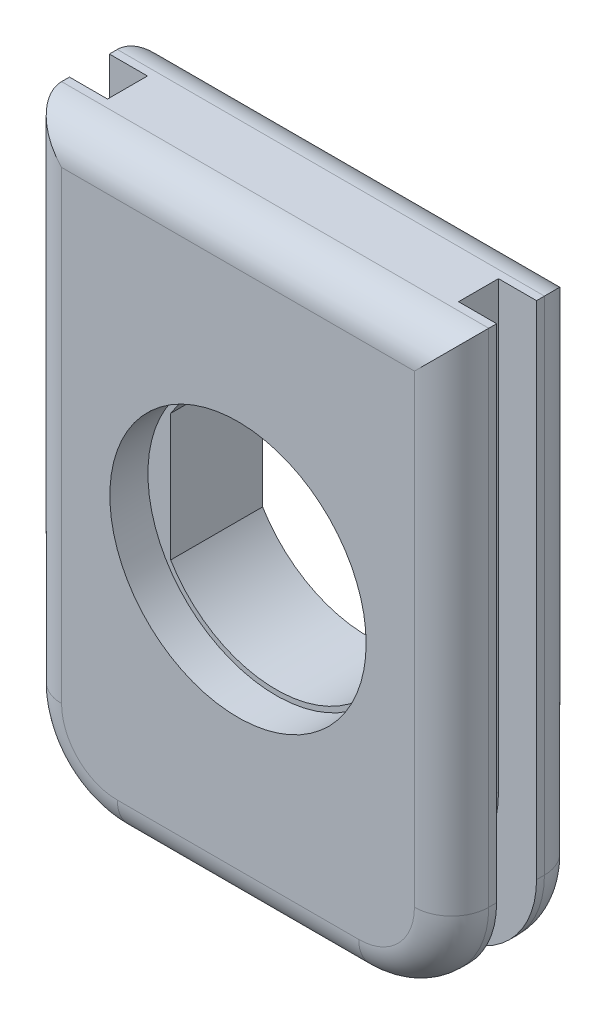
from build123d import *

# Parameters (mm, degrees)
SKETCH1_W           = 23
SKETCH1_H           = 32
BOSS_EXTRUDE1_DEPTH = 3.5
CUT_EXTRUDE1_DEPTH  = 1.075
FILLET1_R           = 6
FILLET2_R           = 5
FILLET3_R           = 2
CUT_EXTRUDE2_DEPTH  = 21.910523666
SKETCH5_R           = 6.9
CUT_EXTRUDE3_DEPTH  = 2.05


with BuildPart() as part:
    # Sketch1 → Boss-Extrude1 (new, symmetric)
    with BuildSketch(Plane.XY):
        Rectangle(SKETCH1_W, SKETCH1_H)
    extrude(amount=BOSS_EXTRUDE1_DEPTH, both=True)

    # Sketch2 → Cut-Extrude1 (cut, symmetric)
    with BuildSketch(Plane.XY):
        Polygon((-9.45, 16), (-11.5, 16), (-11.5, -16), (11.5, -16), (11.5, 16), (9.45, 16), (9.45, -13.95), (-9.45, -13.95), align=None)
    extrude(amount=CUT_EXTRUDE1_DEPTH, both=True, mode=Mode.SUBTRACT)

    # Fillet1
    fillet1_edges = [part.edges().sort_by_distance(p)[0] for p in [
        (-9.45, -13.95, 0),
        (9.45, -13.95, 0),
    ]]
    fillet(fillet1_edges, radius=FILLET1_R)

    # Fillet2
    fillet2_edges = [part.edges().sort_by_distance(p)[0] for p in [
        (11.5, -16, -2.2875),
        (-11.5, -16, -2.2875),
        (11.5, -16, 2.2875),
        (-11.5, -16, 2.2875),
    ]]
    fillet(fillet2_edges, radius=FILLET2_R)

    # Fillet3
    fillet3_edges = [part.edges().sort_by_distance(p)[0] for p in [
        (0, 16, 3.5),
        (-11.5, 2.5, 3.5),
        (0, 16, -3.5),
        (0, -16, -3.5),
        (11.5, 2.5, -3.5),
        (10.035533906, -14.535533906, -3.5),
        (-10.035533906, -14.535533906, -3.5),
        (-11.5, 2.5, -3.5),
        (0, -16, 3.5),
        (11.5, 2.5, 3.5),
        (10.035533906, -14.535533906, 3.5),
        (-10.035533906, -14.535533906, 3.5),
    ]]
    fillet(fillet3_edges, radius=FILLET3_R)

    # Sketch3 → Cut-Extrude2 (cut, through all)
    with BuildSketch(Plane.XY.offset(3.5)):
        with BuildLine():
            Line((-5.675, 3.418332927), (-5.675, -3.418332927))
            ThreePointArc((-5.675, -3.418332927), (0, -6.625), (5.675, -3.418332927))
            Line((5.675, -3.418332927), (5.675, 3.418332927))
            ThreePointArc((5.675, 3.418332927), (0, 6.625), (-5.675, 3.418332927))
        make_face()
    extrude(amount=-CUT_EXTRUDE2_DEPTH, mode=Mode.SUBTRACT)

    # Sketch5 → Cut-Extrude3 (cut)
    with BuildSketch(Plane.XY.offset(3.5)):
        Circle(SKETCH5_R)
    extrude(amount=-CUT_EXTRUDE3_DEPTH, mode=Mode.SUBTRACT)


solid = part.part
